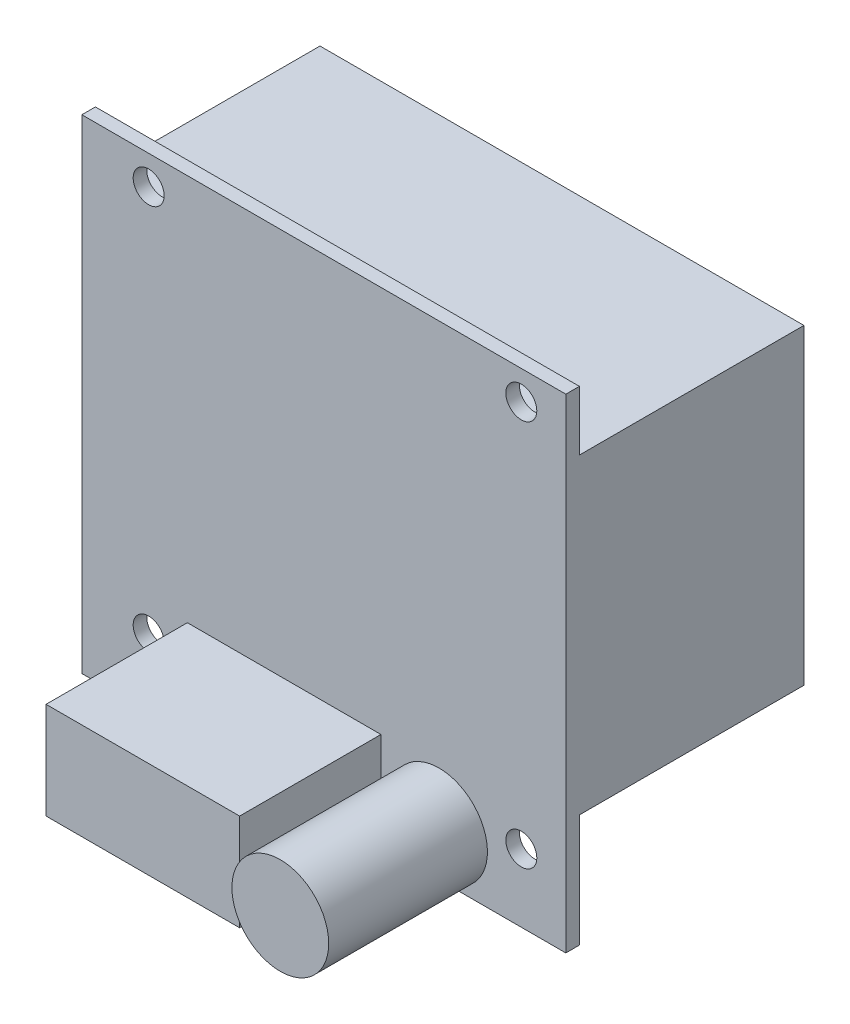
from build123d import *

# Parameters (mm, degrees)
CROQUIS2_W              = 50
CROQUIS2_H              = 50
SALIENTE_EXTRUIR1_DEPTH = 1.4
CROQUIS3_R              = 1.6
CORTAR_EXTRUIR1_DEPTH   = 1.4
CROQUIS4_W              = 50
CROQUIS4_H              = 32.2
SALIENTE_EXTRUIR2_DEPTH = 23.2
SALIENTE_EXTRUIR3_DEPTH = 14.6
CROQUIS6_R              = 5
SALIENTE_EXTRUIR4_DEPTH = 16.4


with BuildPart() as part:
    # Croquis2 → Saliente-Extruir1 (new body)
    with BuildSketch(Plane.XY):
        Rectangle(CROQUIS2_W, CROQUIS2_H)
    extrude(amount=SALIENTE_EXTRUIR1_DEPTH)

    # Croquis3 → Cortar-Extruir1 (cut)
    with BuildSketch(Plane.XY.offset(1.4)):
        with Locations((20.4, 22)):
            Circle(CROQUIS3_R)
        with Locations((20.4, -18)):
            Circle(CROQUIS3_R)
        with Locations((-18.1, 22)):
            Circle(CROQUIS3_R)
        with Locations((-18.1, -18)):
            Circle(CROQUIS3_R)
    extrude(amount=-CORTAR_EXTRUIR1_DEPTH, mode=Mode.SUBTRACT)

    # Croquis4 → Saliente-Extruir2 (add)
    with BuildSketch(Plane(origin=(0, 0, 0), x_dir=(-1, 0, 0), z_dir=(0, 0, -1))):
        with Locations((0, 2.75)):
            Rectangle(CROQUIS4_W, CROQUIS4_H)
    extrude(amount=SALIENTE_EXTRUIR2_DEPTH)

    # Croquis5 → Saliente-Extruir3 (add)
    with BuildSketch(Plane.XY.offset(1.4)):
        Polygon((-14.1, -18), (-14.1, -25), (5.9, -25), (5.9, -15), (-14.1, -15), align=None)
    extrude(amount=SALIENTE_EXTRUIR3_DEPTH)

    # Croquis6 → Saliente-Extruir4 (add)
    with BuildSketch(Plane.XY.offset(1.4)):
        with Locations(Location((11.9, -20, 0), (0, 0, 270))):
            Circle(CROQUIS6_R)
    extrude(amount=SALIENTE_EXTRUIR4_DEPTH)


solid = part.part
